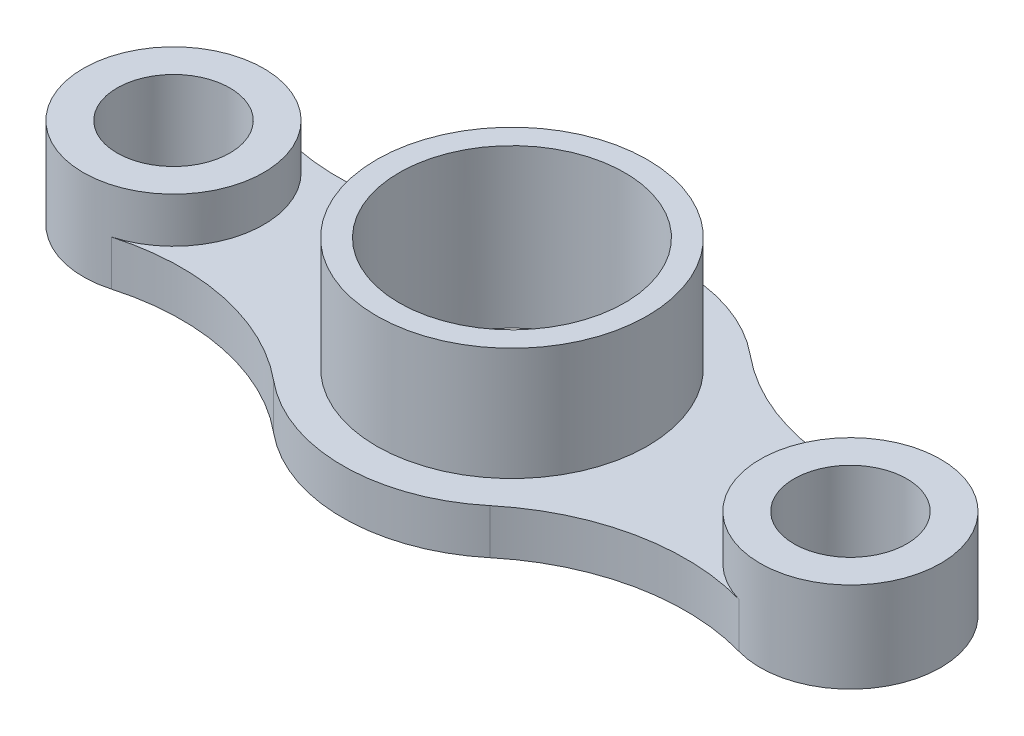
from build123d import *

# Parameters (mm, degrees)
BOSS_EXTRUDE1_DEPTH = 20
SKETCH2_R           = 60
BOSS_EXTRUDE2_DEPTH = 50
SKETCH3_R           = 40
BOSS_EXTRUDE3_DEPTH = 20
SKETCH4_R           = 50
SKETCH4_R_2         = 25
CUT_EXTRUDE1_DEPTH  = 70


with BuildPart() as part:
    # Sketch1 → Boss-Extrude1 (new body)
    with BuildSketch(Plane(origin=(0, 0, 0), x_dir=(1, 0, 0), z_dir=(0, 1, 0))):
        with BuildLine():
            ThreePointArc((-47.892857143, -57.717191847), (0, -75), (47.892857143, -57.717191847))
            ThreePointArc((47.892857143, -57.717191847), (91.104177178, -36.827906099), (139.071428571, -38.478127898))
            ThreePointArc((139.071428571, -38.478127898), (190, 0), (139.071428571, 38.478127898))
            ThreePointArc((139.071428571, 38.478127898), (91.104177178, 36.827906099), (47.892857143, 57.717191847))
            ThreePointArc((47.892857143, 57.717191847), (0, 75), (-47.892857143, 57.717191847))
            ThreePointArc((-47.892857143, 57.717191847), (-91.104177178, 36.827906099), (-139.071428571, 38.478127898))
            ThreePointArc((-139.071428571, 38.478127898), (-190, 0), (-139.071428571, -38.478127898))
            ThreePointArc((-139.071428571, -38.478127898), (-91.104177178, -36.827906099), (-47.892857143, -57.717191847))
        make_face()
    extrude(amount=BOSS_EXTRUDE1_DEPTH)

    # Sketch2 → Boss-Extrude2 (add)
    with BuildSketch(Plane(origin=(0, 20, 0), x_dir=(1, 0, 0), z_dir=(0, 1, 0))):
        with Locations(Location((0, 0, 0), (0, 0, 90))):
            Circle(SKETCH2_R)
    extrude(amount=BOSS_EXTRUDE2_DEPTH)

    # Sketch3 → Boss-Extrude3 (add)
    with BuildSketch(Plane(origin=(0, 20, 0), x_dir=(1, 0, 0), z_dir=(0, 1, 0))):
        with Locations(Location((-150, 0, 0), (0, 0, 74.144374523))):
            Circle(SKETCH3_R)
        with Locations(Location((150, 0, 0), (0, 0, 105.855625477))):
            Circle(SKETCH3_R)
    extrude(amount=BOSS_EXTRUDE3_DEPTH)

    # Sketch4 → Cut-Extrude1 (cut)
    with BuildSketch(Plane(origin=(0, 70, 0), x_dir=(1, 0, 0), z_dir=(0, 1, 0))):
        with Locations(Location((0, 0, 0), (0, 0, 270))):
            Circle(SKETCH4_R)
        with Locations(Location((-150, 0, 0), (0, 0, 270))):
            Circle(SKETCH4_R_2)
        with Locations(Location((150, 0, 0), (0, 0, 270))):
            Circle(SKETCH4_R_2)
    extrude(amount=-CUT_EXTRUDE1_DEPTH, mode=Mode.SUBTRACT)


solid = part.part
